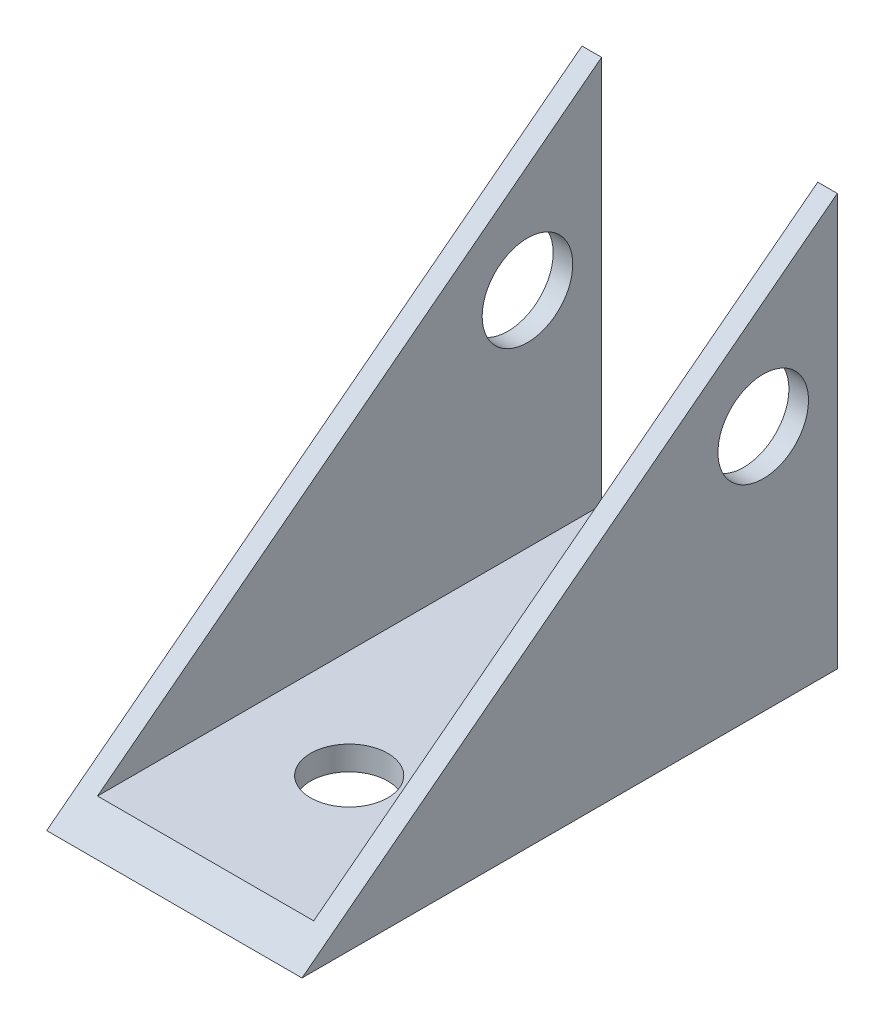
from build123d import *

# Parameters (mm, degrees)
SKETCH1_R           = 5.5
BOSS_EXTRUDE1_DEPTH = 31
SKETCH2_W           = 26.247455066
SKETCH2_H           = 52.217390052
CUT_EXTRUDE1_DEPTH  = 88.669835177
SKETCH5_R           = 4.688216148
CUT_EXTRUDE2_DEPTH  = 87.036927024


with BuildPart() as part:
    # Sketch1 → Boss-Extrude1 (new body)
    with BuildSketch(Plane(origin=(0, 0, 0), x_dir=(0, 0, -1), z_dir=(1, 0, 0))):
        Polygon((0, 0), (65, 0), (65, 50), align=None)
        with Locations((56, 30)):
            Circle(SKETCH1_R, mode=Mode.SUBTRACT)
    extrude(amount=BOSS_EXTRUDE1_DEPTH)

    # Sketch2 → Cut-Extrude1 (cut, through all)
    with BuildSketch(Plane(origin=(0, 0, -65), x_dir=(-1, 0, 0), z_dir=(0, 0, -1))):
        with Locations((-15.5, 29.030538608)):
            Rectangle(SKETCH2_W, SKETCH2_H)
    extrude(amount=-CUT_EXTRUDE1_DEPTH, mode=Mode.SUBTRACT)

    # Sketch5 → Cut-Extrude2 (cut, through all)
    with BuildSketch(Plane(origin=(0, 2.921843582, 0), x_dir=(1, 0, 0), z_dir=(0, 1, 0))):
        with Locations(Location((15.5, 21.230034951, 0), (0, 0, 180))):
            Circle(SKETCH5_R)
        with BuildLine():
            Line((18.601825243, 76.649312621), (18.601825243, 60.933398058))
            ThreePointArc((18.601825243, 60.933398058), (15.5, 57.831572816), (12.398174757, 60.933398058))
            Line((12.398174757, 60.933398058), (12.398174757, 76.649312621))
            ThreePointArc((12.398174757, 76.649312621), (15.5, 79.751137864), (18.601825243, 76.649312621))
        make_face()
    extrude(amount=-CUT_EXTRUDE2_DEPTH, mode=Mode.SUBTRACT)


solid = part.part
